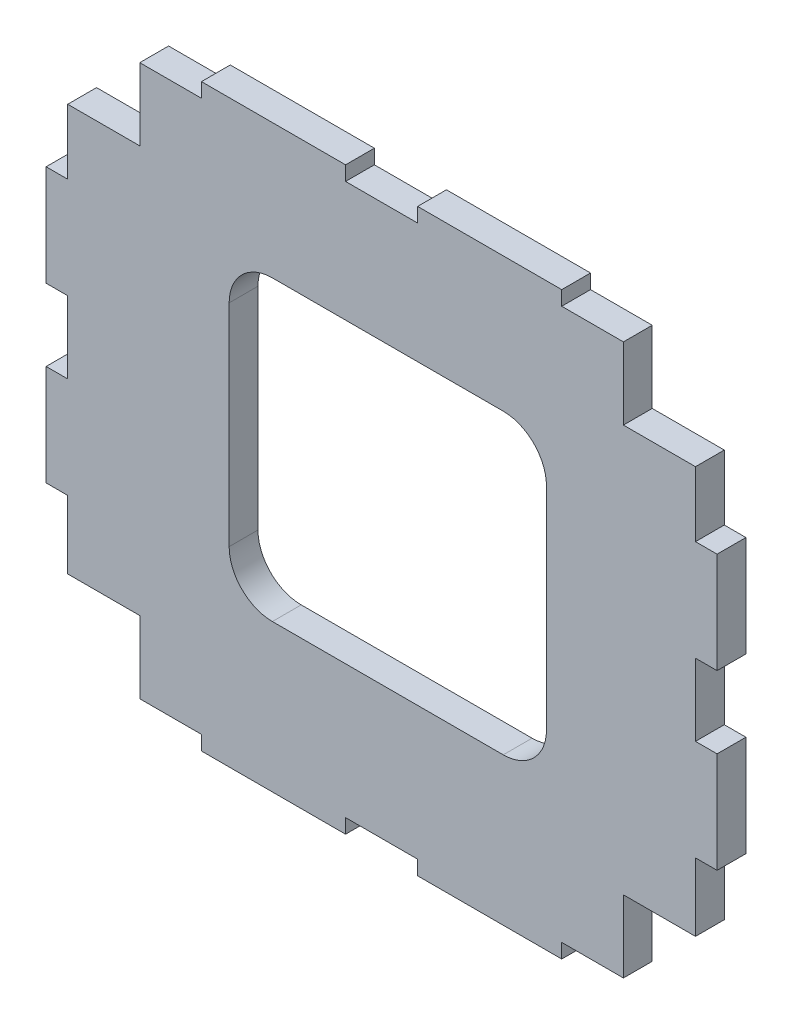
from build123d import *

# Parameters (mm, degrees)
EXTRUDE_1_DEPTH = 2


with BuildPart() as part:
    # Model → 凸台-拉伸1 (new body)
    with BuildSketch(Plane.XY):
        Polygon((19.797398622, 42.279641755), (24.077398622, 42.279641755), (24.077398622, 43.279997461), (34.077398622, 43.279997461), (34.077398622, 42.279641755), (39.077398622, 42.279641755), (39.077398622, 43.279997461), (49.077398622, 43.279997461), (49.077398622, 42.279641755), (53.357398622, 42.279641755), (53.357398622, 37.279641755), (58.357398622, 37.279641755), (58.357398622, 32.773402746), (59.857398622, 32.773402746), (59.857398622, 25.773402746), (58.357398622, 25.773402746), (58.357398622, 20.773402746), (59.857398622, 20.773402746), (59.857398622, 13.773402746), (58.357398622, 13.773402746), (58.357398622, 9.052775369), (53.357398622, 9.052775369), (53.357398622, 4.052775369), (49.077398622, 4.052775369), (49.077398622, 3.052419663), (39.077398622, 3.052419663), (39.077398622, 4.052775369), (34.077398622, 4.052775369), (34.077398622, 3.052419663), (24.077398622, 3.052419663), (24.077398622, 4.052775369), (19.797398622, 4.052775369), (19.797398622, 9.052775369), (14.797398622, 9.052775369), (14.797398622, 13.773402746), (13.297398622, 13.773402746), (13.297398622, 20.773402746), (14.797398622, 20.773402746), (14.797398622, 25.773402746), (13.297398622, 25.773402746), (13.297398622, 32.773402746), (14.797398622, 32.773402746), (14.797398622, 37.279641755), (19.797398622, 37.279641755), align=None)
        with BuildLine():
            Line((45.019762396, 33.94579932), (28.999762396, 33.94579932))
            ThreePointArc((28.999762396, 33.94579932), (26.878442052, 33.067119664), (25.999762396, 30.94579932))
            Line((25.999762396, 30.94579932), (25.999762396, 16.29579932))
            ThreePointArc((25.999762396, 16.29579932), (26.878442052, 14.174478977), (28.999762396, 13.29579932))
            Line((28.999762396, 13.29579932), (45.019762396, 13.29579932))
            ThreePointArc((45.019762396, 13.29579932), (47.141082739, 14.174478977), (48.019762396, 16.29579932))
            Line((48.019762396, 16.29579932), (48.019762396, 30.94579932))
            ThreePointArc((48.019762396, 30.94579932), (47.141082739, 33.067119664), (45.019762396, 33.94579932))
        make_face(mode=Mode.SUBTRACT)
    extrude(amount=EXTRUDE_1_DEPTH)


solid = part.part
